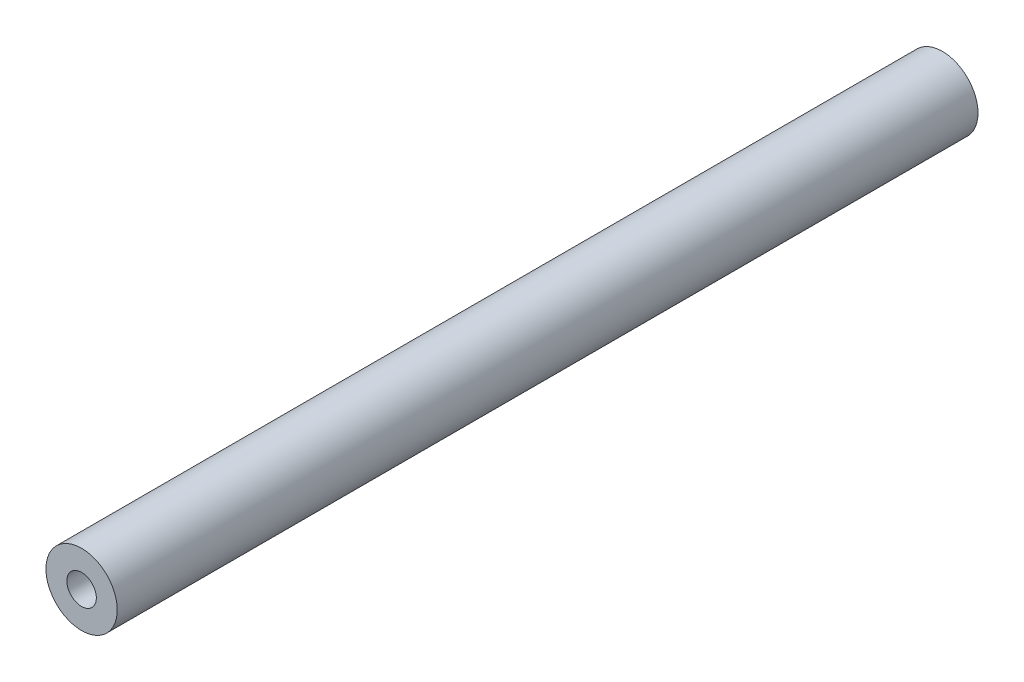
from build123d import *

# Parameters (mm, degrees)
SKETCH2_R           = 7.366
SKETCH2_R_2         = 3.048
BOSS_EXTRUDE1_DEPTH = 177.8


with BuildPart() as part:
    # Sketch2 → Boss-Extrude1 (new body)
    with BuildSketch(Plane.XY):
        Circle(SKETCH2_R)
        Circle(SKETCH2_R_2, mode=Mode.SUBTRACT)
    extrude(amount=BOSS_EXTRUDE1_DEPTH)


solid = part.part
